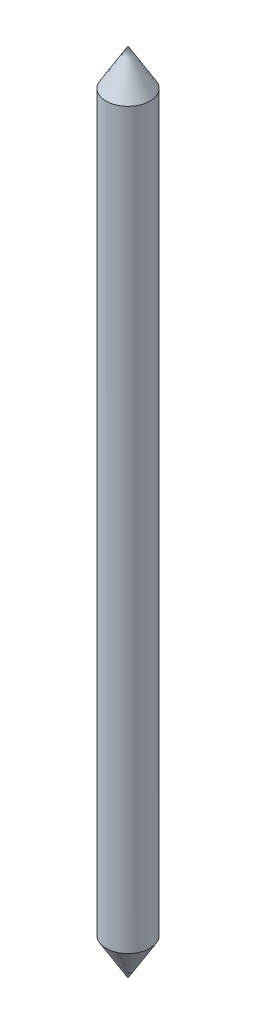
from build123d import *


with BuildPart() as part:
    # Sketch1 → Revolve1 (revolve)
    with BuildSketch(Plane(origin=(0, 0, 0), x_dir=(0, 0, -1), z_dir=(1, 0, 0))):
        Polygon((0, -139.7), (0, 139.7), (7.62, 127), (7.62, -127), align=None)
    revolve(axis=Axis((0, -139.7, 0), (0, 1, 0)))


solid = part.part
